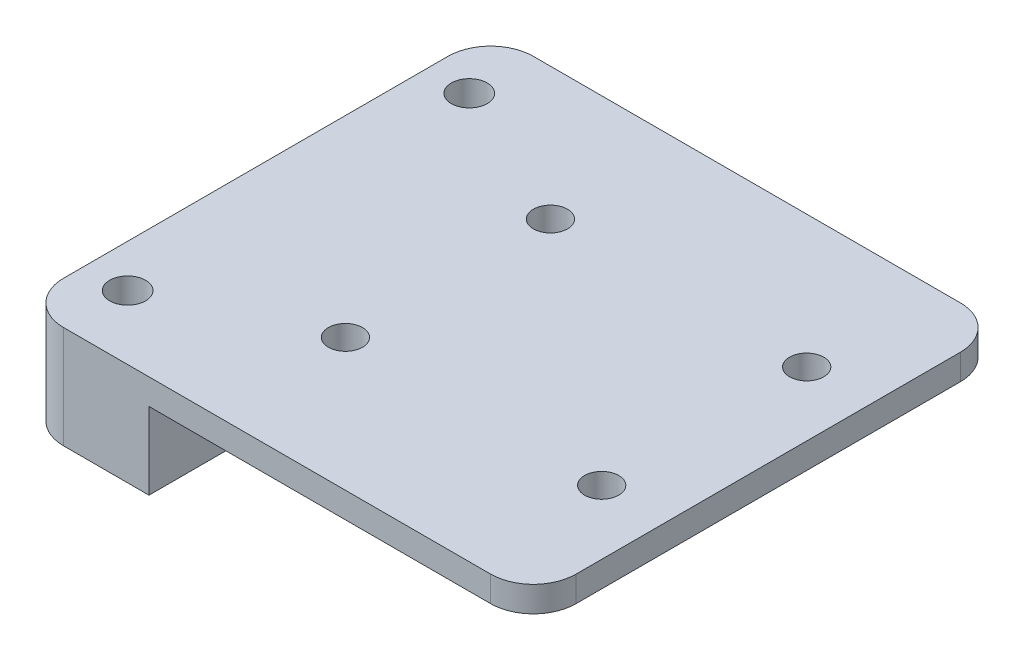
from build123d import *

# Parameters (mm, degrees)
SKETCH1_W                 = 60
SKETCH1_H                 = 55
BOSS_EXTRUDE1_DEPTH       = 12
SKETCH2_W                 = 45
SKETCH2_H                 = 55
CUT_EXTRUDE2_DEPTH        = 9
M5_TAPPED_HOLE1_D         = 4.2
M5_TAPPED_HOLE1_DEPTH     = 12.4
M5_TAPPED_HOLE1_TIP       = 1.2618073
FILLET1_R                 = 5
F_4_0MM_DOWEL_HOLE2_D     = 4
F_4_0MM_DOWEL_HOLE2_DEPTH = 12.4
F_4_0MM_DOWEL_HOLE2_TIP   = 1.201721238


with BuildPart() as part:
    # Sketch1 → Boss-Extrude1 (new body)
    with BuildSketch(Plane(origin=(0, 0, 0), x_dir=(1, 0, 0), z_dir=(0, 1, 0))):
        Rectangle(SKETCH1_W, SKETCH1_H)
    extrude(amount=BOSS_EXTRUDE1_DEPTH)

    # Sketch2 → Cut-Extrude2 (cut)
    with BuildSketch(Plane.XZ):
        with Locations((7.5, 0)):
            Rectangle(SKETCH2_W, SKETCH2_H)
    extrude(amount=-CUT_EXTRUDE2_DEPTH, mode=Mode.SUBTRACT)

    # M5 Tapped Hole1
    with Locations(Plane(origin=(-25, 12, -20), x_dir=(0, 0, 1), z_dir=(0, 1, 0))):
        with Locations((0, 0), (40, 0)):
            Hole(M5_TAPPED_HOLE1_D / 2, depth=M5_TAPPED_HOLE1_DEPTH)
            with Locations((0, 0, -(M5_TAPPED_HOLE1_DEPTH + M5_TAPPED_HOLE1_TIP / 2))):  # 118° drill point
                Cone(0, M5_TAPPED_HOLE1_D / 2, M5_TAPPED_HOLE1_TIP, mode=Mode.SUBTRACT)

    # Fillet1
    fillet1_edges = [part.edges().sort_by_distance(p)[0] for p in [
        (30, 10.5, 27.5),
        (-30, 6, 27.5),
        (-30, 6, -27.5),
        (30, 10.5, -27.5),
    ]]
    fillet(fillet1_edges, radius=FILLET1_R)

    # Ø4.0mm Dowel Hole2
    with Locations(Plane(origin=(-7.5, 12, -12), x_dir=(0, 0, 1), z_dir=(0, 1, 0))):
        with Locations((0, 0), (24, 0), (24, 30), (0, 30)):
            Hole(F_4_0MM_DOWEL_HOLE2_D / 2, depth=F_4_0MM_DOWEL_HOLE2_DEPTH)
            with Locations((0, 0, -(F_4_0MM_DOWEL_HOLE2_DEPTH + F_4_0MM_DOWEL_HOLE2_TIP / 2))):  # 118° drill point
                Cone(0, F_4_0MM_DOWEL_HOLE2_D / 2, F_4_0MM_DOWEL_HOLE2_TIP, mode=Mode.SUBTRACT)


solid = part.part
